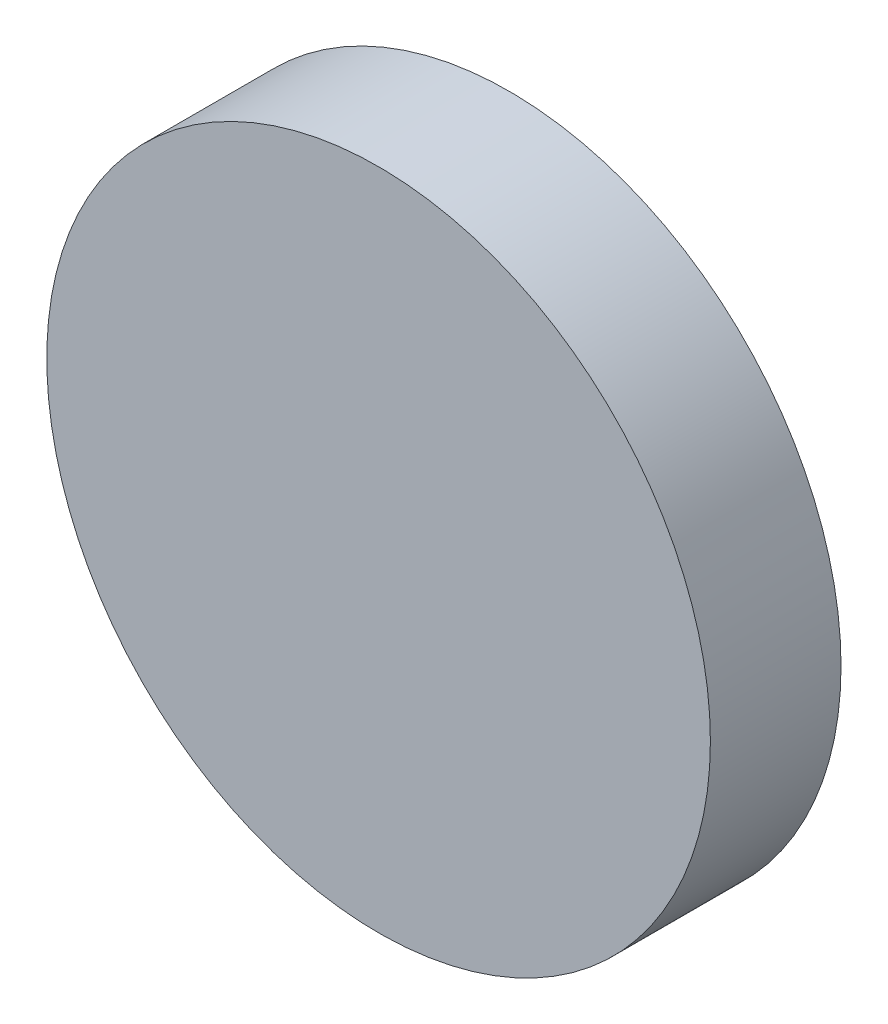
from build123d import *

# Parameters (mm, degrees)
SKETCH1_R           = 25.4
BOSS_EXTRUDE1_DEPTH = 10


with BuildPart() as part:
    # Sketch1 → Boss-Extrude1 (new body)
    with BuildSketch(Plane.XY):
        Circle(SKETCH1_R)
    extrude(amount=BOSS_EXTRUDE1_DEPTH)


solid = part.part
